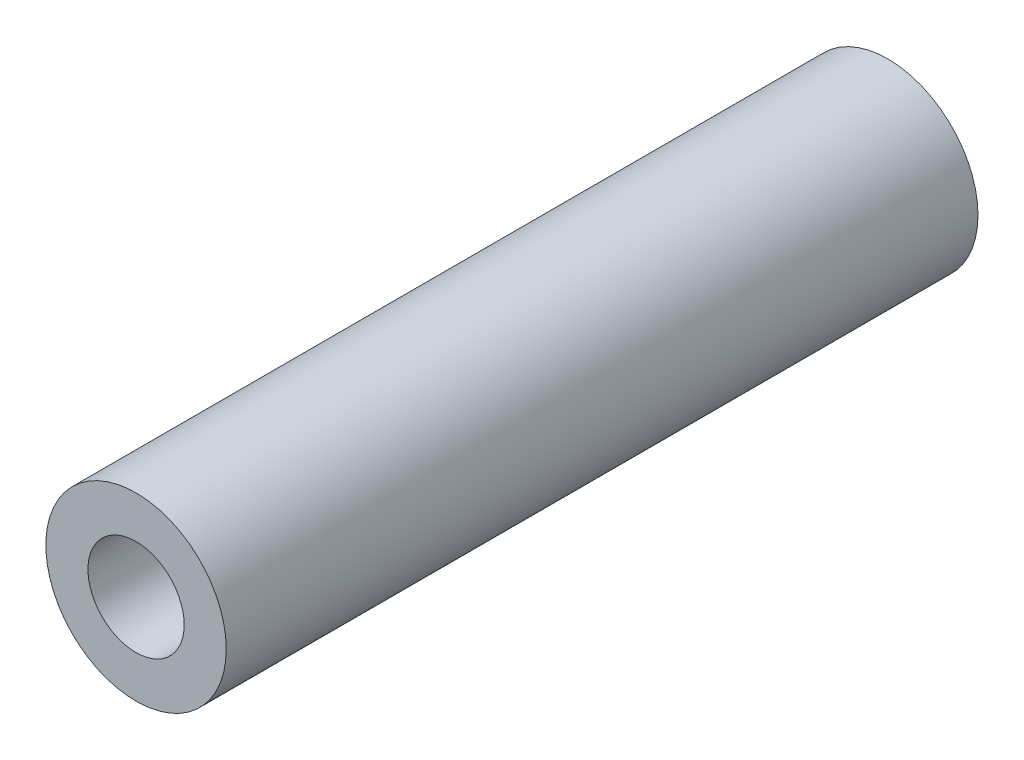
from build123d import *

# Parameters (mm, degrees)
SKETCH_1_R      = 3
SKETCH_1_R_2    = 1.6
EXTRUDE_1_DEPTH = 25


with BuildPart() as part:
    # 草图1 → 凸台-拉伸1 (new body)
    with BuildSketch(Plane.XY):
        Circle(SKETCH_1_R)
        Circle(SKETCH_1_R_2, mode=Mode.SUBTRACT)
    extrude(amount=EXTRUDE_1_DEPTH)


solid = part.part
